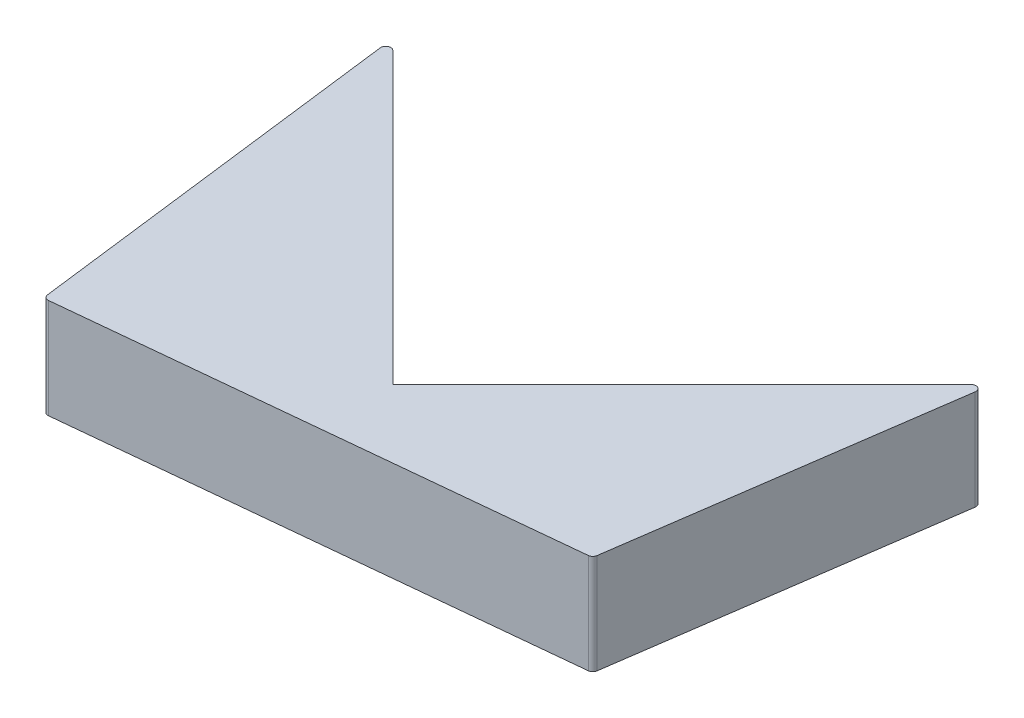
from build123d import *

# Parameters (mm, degrees)
BOSS_EXTRUDE1_DEPTH = 10
FILLET1_R           = 0.5


with BuildPart() as part:
    # Sketch1 → Boss-Extrude1 (new body)
    with BuildSketch(Plane(origin=(0, 0, 0), x_dir=(1, 0, 0), z_dir=(0, 1, 0))):
        Polygon((0, 0), (30, 30), (25, -5), (-25, -10), (-30, 30), align=None)
    extrude(amount=BOSS_EXTRUDE1_DEPTH)

    # Fillet1
    fillet1_edges = [part.edges().sort_by_distance(p)[0] for p in [
        (30, 5, -30),
        (25, 5, 5),
        (-25, 5, 10),
        (-30, 5, -30),
    ]]
    fillet(fillet1_edges, radius=FILLET1_R)


solid = part.part
